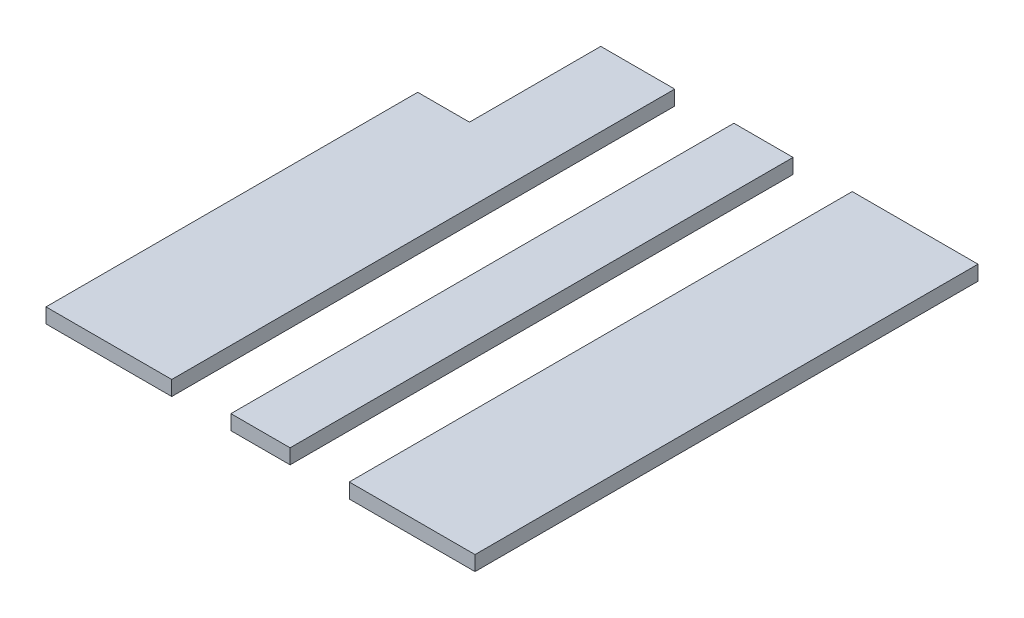
from build123d import *

# Parameters (mm, degrees)
EXTRUDE2_DEPTH          = 12.7
SKETCH3_W               = 463.121935294
SKETCH3_H               = 86.735895098
CUT_EXTRUDE1_DEPTH      = 505.854951942
CUT_EXTRUDE2_DEPTH      = 505.854951942
SKETCH5_W               = 50.8
SKETCH5_H               = 476.704079848
CUT_EXTRUDE3_DEPTH      = 505.854951942
CUT_EXTRUDE4_DEPTH      = 505.854951942
CUT_EXTRUDE4_DEPTH_BACK = 505.854951942


with BuildPart() as part:
    # Sketch2 → Extrude2 (new body)
    with BuildSketch(Plane(origin=(0, 0, 0), x_dir=(1, 0, 0), z_dir=(0, 1, 0))):
        with BuildLine():
            Line((180.975, 469.9), (-180.975, 469.9))
            Line((-180.975, 469.9), (-184.15, 469.9))
            Line((-184.15, 469.9), (-184.15, 466.725))
            Line((-184.15, 466.725), (-184.15, 15.875))
            ThreePointArc((-184.15, 15.875), (-183.22006403, 13.62993597), (-180.975, 12.7))
            Line((-180.975, 12.7), (180.975, 12.7))
            ThreePointArc((180.975, 12.7), (183.22006403, 13.62993597), (184.15, 15.875))
            Line((184.15, 15.875), (184.15, 466.725))
            Line((184.15, 466.725), (184.15, 469.9))
            Line((184.15, 469.9), (180.975, 469.9))
        make_face()
    extrude(amount=EXTRUDE2_DEPTH)

    # Sketch3 → Cut-Extrude1 (cut, through all)
    with BuildSketch(Plane(origin=(0, 0, 0), x_dir=(1, 0, 0), z_dir=(0, 1, 0))):
        with Locations((0, -5.267947549)):
            Rectangle(SKETCH3_W, SKETCH3_H)
    extrude(amount=CUT_EXTRUDE1_DEPTH, mode=Mode.SUBTRACT)

    # Sketch4 → Cut-Extrude2 (cut, through all)
    with BuildSketch(Plane(origin=(0, 0, 0), x_dir=(1, 0, 0), z_dir=(0, 1, 0))):
        with BuildLine():
            Line((-165.1, 408.0002), (-203.365160902, 408.0002))
            Line((-203.365160902, 408.0002), (-203.365160902, 357.2002))
            Line((-203.365160902, 357.2002), (-165.1, 357.2002))
            ThreePointArc((-165.1, 357.2002), (-139.7, 382.6002), (-165.1, 408.0002))
        make_face()
    extrude(amount=CUT_EXTRUDE2_DEPTH, mode=Mode.SUBTRACT)

    # Sketch5 → Cut-Extrude3 (cut, through all)
    with BuildSketch(Plane(origin=(0, 0, 0), x_dir=(1, 0, 0), z_dir=(0, 1, 0))):
        with Locations((-50.8, 248.428767098)):
            Rectangle(SKETCH5_W, SKETCH5_H)
        with Locations((50.8, 248.428767098)):
            Rectangle(SKETCH5_W, SKETCH5_H)
    extrude(amount=CUT_EXTRUDE3_DEPTH, mode=Mode.SUBTRACT)


with BuildPart() as cut_extrude3_piece_1:
    # of the separate pieces the step leaves, piece 1, a body of its own (cut_extrude3_pieces)
    add(part.part.solids().sort_by_distance((184.15, 0, -469.9))[0])


with BuildPart() as cut_extrude3_piece_2:
    # of the separate pieces the step leaves, piece 2, a body of its own (cut_extrude3_pieces)
    add(part.part.solids().sort_by_distance((-76.2, 0, -469.9))[0])

    # Sketch6 → Cut-Extrude4 (cut, two sides: drawn at the far end of the back side and taken through both)
    with BuildSketch(Plane(origin=(0, 12.7, 0), x_dir=(-1, 0, 0), z_dir=(0, 1, 0)).offset(-CUT_EXTRUDE4_DEPTH_BACK)):
        Polygon((1273.65, -357.2002), (184.15, -357.2002), (139.7, -357.2002), (139.7, -469.9), (139.7, -1559.4), (1724.822887689, -3054.534251806), (2858.772887689, -1852.334451806), align=None)
    extrude(amount=CUT_EXTRUDE4_DEPTH + CUT_EXTRUDE4_DEPTH_BACK, mode=Mode.SUBTRACT)


with BuildPart() as cut_extrude3_piece_3:
    # of the separate pieces the step leaves, piece 3, a body of its own (cut_extrude3_pieces)
    add(part.part.solids().sort_by_distance((25.4, 0, -469.9))[0])


solid = Compound([cut_extrude3_piece_1.part, cut_extrude3_piece_2.part, cut_extrude3_piece_3.part])
